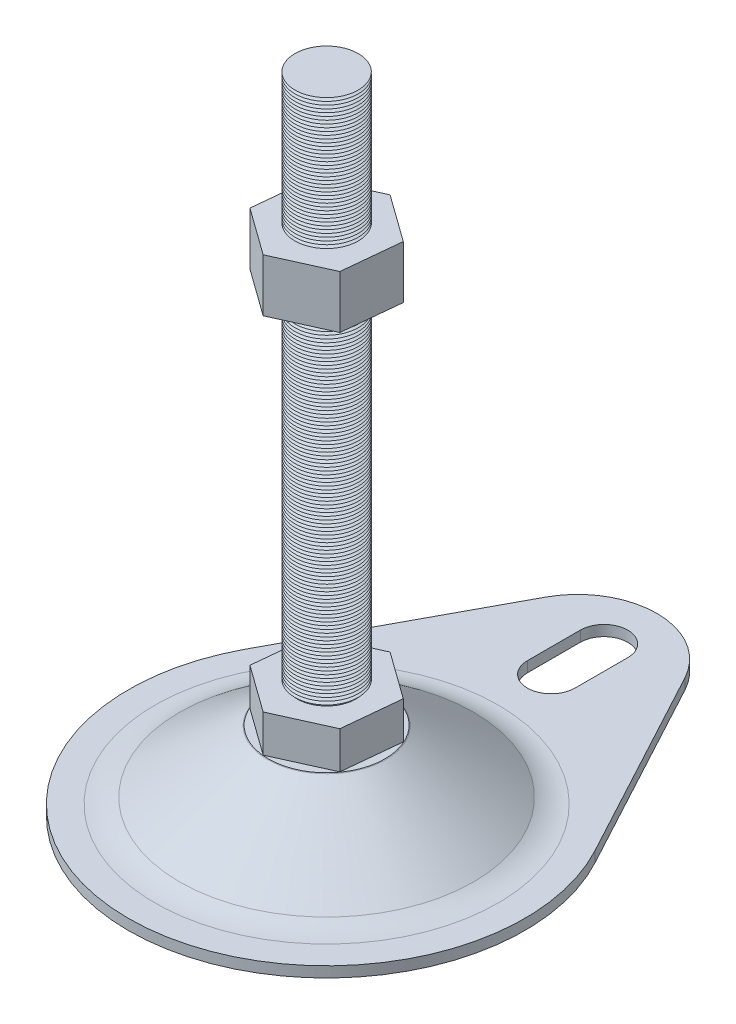
from build123d import *

# Parameters (mm, degrees)
SKETCH_3_W          = 59.979530128
SKETCH_3_H          = 60.096309618
CUT_EXTRUDE_1_DEPTH = 82
EXTRUDE_START       = -2
EXTRUDE_1_DEPTH     = 2
CUT_EXTRUDE_2_DEPTH = 141.401210821


with BuildPart() as part:
    # 草图1 → 旋转1 (revolve)
    with BuildSketch(Plane.XY, mode=Mode.PRIVATE) as revolve_1_sk:
        with BuildLine():
            Line((37.5, -12), (37.5, -14))
            Line((37.5, -14), (32.460490166, -14))
            ThreePointArc((32.460490166, -14), (29.593413351, -13.652461995), (26.89240623, -12.629978423))
            Line((26.89240623, -12.629978423), (10.251565792, -0.913347718))
            ThreePointArc((10.251565792, -0.913347718), (8.450894377, -0.231692003), (6.539509834, 0))
            Line((6.539509834, 0), (0, 0))
            Line((0, 0), (0, 108))
            Line((0, 108), (5.986831427, 108))
            Line((5.986831427, 108), (5.1, 107.695418126))
            Line((5.1, 107.695418126), (6, 107.386313512))
            Line((6, 107.386313512), (5.1, 107.077208897))
            Line((5.1, 107.077208897), (6, 106.768104283))
            Line((6, 106.768104283), (5.1, 106.458999669))
            Line((5.1, 106.458999669), (6, 106.149895054))
            Line((6, 106.149895054), (5.1, 105.84079044))
            Line((5.1, 105.84079044), (6, 105.531685826))
            Line((6, 105.531685826), (5.1, 105.222581211))
            Line((5.1, 105.222581211), (6, 104.913476597))
            Line((6, 104.913476597), (5.1, 104.604371983))
            Line((5.1, 104.604371983), (6, 104.295267368))
            Line((6, 104.295267368), (5.1, 103.986162754))
            Line((5.1, 103.986162754), (6, 103.677058139))
            Line((6, 103.677058139), (5.1, 103.367953525))
            Line((5.1, 103.367953525), (6, 103.058848911))
            Line((6, 103.058848911), (5.1, 102.749744296))
            Line((5.1, 102.749744296), (6, 102.440639682))
            Line((6, 102.440639682), (5.1, 102.131535068))
            Line((5.1, 102.131535068), (6, 101.822430453))
            Line((6, 101.822430453), (5.1, 101.513325839))
            Line((5.1, 101.513325839), (6, 101.204221225))
            Line((6, 101.204221225), (5.1, 100.89511661))
            Line((5.1, 100.89511661), (6, 100.586011996))
            Line((6, 100.586011996), (5.1, 100.276907381))
            Line((5.1, 100.276907381), (6, 99.967802767))
            Line((6, 99.967802767), (5.1, 99.658698153))
            Line((5.1, 99.658698153), (6, 99.349593538))
            Line((6, 99.349593538), (5.1, 99.040488924))
            Line((5.1, 99.040488924), (6, 98.73138431))
            Line((6, 98.73138431), (5.1, 98.422279695))
            Line((5.1, 98.422279695), (6, 98.113175081))
            Line((6, 98.113175081), (5.1, 97.804070467))
            Line((5.1, 97.804070467), (6, 97.494965852))
            Line((6, 97.494965852), (5.1, 97.185861238))
            Line((5.1, 97.185861238), (6, 96.876756623))
            Line((6, 96.876756623), (5.1, 96.567652009))
            Line((5.1, 96.567652009), (6, 96.258547395))
            Line((6, 96.258547395), (5.1, 95.94944278))
            Line((5.1, 95.94944278), (6, 95.640338166))
            Line((6, 95.640338166), (5.1, 95.331233552))
            Line((5.1, 95.331233552), (6, 95.022128937))
            Line((6, 95.022128937), (5.1, 94.713024323))
            Line((5.1, 94.713024323), (6, 94.403919709))
            Line((6, 94.403919709), (5.1, 94.094815094))
            Line((5.1, 94.094815094), (6, 93.78571048))
            Line((6, 93.78571048), (5.1, 93.476605865))
            Line((5.1, 93.476605865), (6, 93.167501251))
            Line((6, 93.167501251), (5.1, 92.858396637))
            Line((5.1, 92.858396637), (6, 92.549292022))
            Line((6, 92.549292022), (5.1, 92.240187408))
            Line((5.1, 92.240187408), (6, 91.931082794))
            Line((6, 91.931082794), (5.1, 91.621978179))
            Line((5.1, 91.621978179), (6, 91.312873565))
            Line((6, 91.312873565), (5.1, 91.00376895))
            Line((5.1, 91.00376895), (6, 90.694664336))
            Line((6, 90.694664336), (5.1, 90.385559722))
            Line((5.1, 90.385559722), (6, 90.076455107))
            Line((6, 90.076455107), (5.1, 89.767350493))
            Line((5.1, 89.767350493), (6, 89.458245879))
            Line((6, 89.458245879), (5.1, 89.149141264))
            Line((5.1, 89.149141264), (6, 88.84003665))
            Line((6, 88.84003665), (5.1, 88.530932036))
            Line((5.1, 88.530932036), (6, 88.221827421))
            Line((6, 88.221827421), (5.1, 87.912722807))
            Line((5.1, 87.912722807), (6, 87.603618192))
            Line((6, 87.603618192), (5.1, 87.294513578))
            Line((5.1, 87.294513578), (6, 86.985408964))
            Line((6, 86.985408964), (5.1, 86.676304349))
            Line((5.1, 86.676304349), (6, 86.367199735))
            Line((6, 86.367199735), (5.1, 86.058095121))
            Line((5.1, 86.058095121), (6, 85.748990506))
            Line((6, 85.748990506), (5.1, 85.439885892))
            Line((5.1, 85.439885892), (6, 85.130781278))
            Line((6, 85.130781278), (5.1, 84.821676663))
            Line((5.1, 84.821676663), (6, 84.512572049))
            Line((6, 84.512572049), (5.1, 84.203467434))
            Line((5.1, 84.203467434), (6, 83.89436282))
            Line((6, 83.89436282), (5.1, 83.585258206))
            Line((5.1, 83.585258206), (6, 83.276153591))
            Line((6, 83.276153591), (5.1, 82.967048977))
            Line((5.1, 82.967048977), (5.21854677, 82.92633414))
            Line((5.21854677, 82.92633414), (11, 82.92633414))
            Line((11, 82.92633414), (11, 72.92633414))
            Line((11, 72.92633414), (5.534902792, 72.92633414))
            Line((5.534902792, 72.92633414), (6, 72.766596703))
            Line((6, 72.766596703), (5.1, 72.457492089))
            Line((5.1, 72.457492089), (6, 72.148387474))
            Line((6, 72.148387474), (5.1, 71.83928286))
            Line((5.1, 71.83928286), (6, 71.530178245))
            Line((6, 71.530178245), (5.1, 71.221073631))
            Line((5.1, 71.221073631), (6, 70.911969017))
            Line((6, 70.911969017), (5.1, 70.602864402))
            Line((5.1, 70.602864402), (6, 70.293759788))
            Line((6, 70.293759788), (5.1, 69.984655174))
            Line((5.1, 69.984655174), (6, 69.675550559))
            Line((6, 69.675550559), (5.1, 69.366445945))
            Line((5.1, 69.366445945), (6, 69.057341331))
            Line((6, 69.057341331), (5.1, 68.748236716))
            Line((5.1, 68.748236716), (6, 68.439132102))
            Line((6, 68.439132102), (5.1, 68.130027487))
            Line((5.1, 68.130027487), (6, 67.820922873))
            Line((6, 67.820922873), (5.1, 67.511818259))
            Line((5.1, 67.511818259), (6, 67.202713644))
            Line((6, 67.202713644), (5.1, 66.89360903))
            Line((5.1, 66.89360903), (6, 66.584504416))
            Line((6, 66.584504416), (5.1, 66.275399801))
            Line((5.1, 66.275399801), (6, 65.966295187))
            Line((6, 65.966295187), (5.1, 65.657190573))
            Line((5.1, 65.657190573), (6, 65.348085958))
            Line((6, 65.348085958), (5.1, 65.038981344))
            Line((5.1, 65.038981344), (6, 64.729876729))
            Line((6, 64.729876729), (5.1, 64.420772115))
            Line((5.1, 64.420772115), (6, 64.111667501))
            Line((6, 64.111667501), (5.1, 63.802562886))
            Line((5.1, 63.802562886), (6, 63.493458272))
            Line((6, 63.493458272), (5.1, 63.184353658))
            Line((5.1, 63.184353658), (6, 62.875249043))
            Line((6, 62.875249043), (5.1, 62.566144429))
            Line((5.1, 62.566144429), (6, 62.257039815))
            Line((6, 62.257039815), (5.1, 61.9479352))
            Line((5.1, 61.9479352), (6, 61.638830586))
            Line((6, 61.638830586), (5.1, 61.329725971))
            Line((5.1, 61.329725971), (6, 61.020621357))
            Line((6, 61.020621357), (5.1, 60.711516743))
            Line((5.1, 60.711516743), (6, 60.402412128))
            Line((6, 60.402412128), (5.1, 60.093307514))
            Line((5.1, 60.093307514), (6, 59.7842029))
            Line((6, 59.7842029), (5.1, 59.475098285))
            Line((5.1, 59.475098285), (6, 59.165993671))
            Line((6, 59.165993671), (5.1, 58.856889056))
            Line((5.1, 58.856889056), (6, 58.547784442))
            Line((6, 58.547784442), (5.1, 58.238679828))
            Line((5.1, 58.238679828), (6, 57.929575213))
            Line((6, 57.929575213), (5.1, 57.620470599))
            Line((5.1, 57.620470599), (6, 57.311365985))
            Line((6, 57.311365985), (5.1, 57.00226137))
            Line((5.1, 57.00226137), (6, 56.693156756))
            Line((6, 56.693156756), (5.1, 56.384052142))
            Line((5.1, 56.384052142), (6, 56.074947527))
            Line((6, 56.074947527), (5.1, 55.765842913))
            Line((5.1, 55.765842913), (6, 55.456738298))
            Line((6, 55.456738298), (5.1, 55.147633684))
            Line((5.1, 55.147633684), (6, 54.83852907))
            Line((6, 54.83852907), (5.1, 54.529424455))
            Line((5.1, 54.529424455), (6, 54.220319841))
            Line((6, 54.220319841), (5.1, 53.911215227))
            Line((5.1, 53.911215227), (6, 53.602110612))
            Line((6, 53.602110612), (5.1, 53.293005998))
            Line((5.1, 53.293005998), (6, 52.983901384))
            Line((6, 52.983901384), (5.1, 52.674796769))
            Line((5.1, 52.674796769), (6, 52.365692155))
            Line((6, 52.365692155), (5.1, 52.05658754))
            Line((5.1, 52.05658754), (6, 51.747482926))
            Line((6, 51.747482926), (5.1, 51.438378312))
            Line((5.1, 51.438378312), (6, 51.129273697))
            Line((6, 51.129273697), (5.1, 50.820169083))
            Line((5.1, 50.820169083), (6, 50.511064469))
            Line((6, 50.511064469), (5.1, 50.201959854))
            Line((5.1, 50.201959854), (6, 49.89285524))
            Line((6, 49.89285524), (5.1, 49.583750626))
            Line((5.1, 49.583750626), (6, 49.274646011))
            Line((6, 49.274646011), (5.1, 48.965541397))
            Line((5.1, 48.965541397), (6, 48.656436782))
            Line((6, 48.656436782), (5.1, 48.347332168))
            Line((5.1, 48.347332168), (6, 48.038227554))
            Line((6, 48.038227554), (5.1, 47.729122939))
            Line((5.1, 47.729122939), (6, 47.420018325))
            Line((6, 47.420018325), (5.1, 47.110913711))
            Line((5.1, 47.110913711), (6, 46.801809096))
            Line((6, 46.801809096), (5.1, 46.492704482))
            Line((5.1, 46.492704482), (6, 46.183599868))
            Line((6, 46.183599868), (5.1, 45.874495253))
            Line((5.1, 45.874495253), (6, 45.565390639))
            Line((6, 45.565390639), (5.1, 45.256286024))
            Line((5.1, 45.256286024), (6, 44.94718141))
            Line((6, 44.94718141), (5.1, 44.638076796))
            Line((5.1, 44.638076796), (6, 44.328972181))
            Line((6, 44.328972181), (5.1, 44.019867567))
            Line((5.1, 44.019867567), (6, 43.710762953))
            Line((6, 43.710762953), (5.1, 43.401658338))
            Line((5.1, 43.401658338), (6, 43.092553724))
            Line((6, 43.092553724), (5.1, 42.783449109))
            Line((5.1, 42.783449109), (6, 42.474344495))
            Line((6, 42.474344495), (5.1, 42.165239881))
            Line((5.1, 42.165239881), (6, 41.856135266))
            Line((6, 41.856135266), (5.1, 41.547030652))
            Line((5.1, 41.547030652), (6, 41.237926038))
            Line((6, 41.237926038), (5.1, 40.928821423))
            Line((5.1, 40.928821423), (6, 40.619716809))
            Line((6, 40.619716809), (5.1, 40.310612195))
            Line((5.1, 40.310612195), (6, 40.00150758))
            Line((6, 40.00150758), (5.1, 39.692402966))
            Line((5.1, 39.692402966), (6, 39.383298351))
            Line((6, 39.383298351), (5.1, 39.074193737))
            Line((5.1, 39.074193737), (6, 38.765089123))
            Line((6, 38.765089123), (5.1, 38.455984508))
            Line((5.1, 38.455984508), (6, 38.146879894))
            Line((6, 38.146879894), (5.1, 37.83777528))
            Line((5.1, 37.83777528), (6, 37.528670665))
            Line((6, 37.528670665), (5.1, 37.219566051))
            Line((5.1, 37.219566051), (6, 36.910461437))
            Line((6, 36.910461437), (5.1, 36.601356822))
            Line((5.1, 36.601356822), (6, 36.292252208))
            Line((6, 36.292252208), (5.1, 35.983147593))
            Line((5.1, 35.983147593), (6, 35.674042979))
            Line((6, 35.674042979), (5.1, 35.364938365))
            Line((5.1, 35.364938365), (6, 35.05583375))
            Line((6, 35.05583375), (5.1, 34.746729136))
            Line((5.1, 34.746729136), (6, 34.437624522))
            Line((6, 34.437624522), (5.1, 34.128519907))
            Line((5.1, 34.128519907), (6, 33.819415293))
            Line((6, 33.819415293), (5.1, 33.510310679))
            Line((5.1, 33.510310679), (6, 33.201206064))
            Line((6, 33.201206064), (5.1, 32.89210145))
            Line((5.1, 32.89210145), (6, 32.582996835))
            Line((6, 32.582996835), (5.1, 32.273892221))
            Line((5.1, 32.273892221), (6, 31.964787607))
            Line((6, 31.964787607), (5.1, 31.655682992))
            Line((5.1, 31.655682992), (6, 31.346578378))
            Line((6, 31.346578378), (5.1, 31.037473764))
            Line((5.1, 31.037473764), (6, 30.728369149))
            Line((6, 30.728369149), (5.1, 30.419264535))
            Line((5.1, 30.419264535), (6, 30.110159921))
            Line((6, 30.110159921), (5.1, 29.801055306))
            Line((5.1, 29.801055306), (6, 29.491950692))
            Line((6, 29.491950692), (5.1, 29.182846077))
            Line((5.1, 29.182846077), (6, 28.873741463))
            Line((6, 28.873741463), (5.1, 28.564636849))
            Line((5.1, 28.564636849), (6, 28.255532234))
            Line((6, 28.255532234), (5.1, 27.94642762))
            Line((5.1, 27.94642762), (6, 27.637323006))
            Line((6, 27.637323006), (5.1, 27.328218391))
            Line((5.1, 27.328218391), (6, 27.019113777))
            Line((6, 27.019113777), (5.1, 26.710009162))
            Line((5.1, 26.710009162), (6, 26.400904548))
            Line((6, 26.400904548), (5.1, 26.091799934))
            Line((5.1, 26.091799934), (6, 25.782695319))
            Line((6, 25.782695319), (5.1, 25.473590705))
            Line((5.1, 25.473590705), (6, 25.164486091))
            Line((6, 25.164486091), (5.1, 24.855381476))
            Line((5.1, 24.855381476), (6, 24.546276862))
            Line((6, 24.546276862), (5.1, 24.237172248))
            Line((5.1, 24.237172248), (6, 23.928067633))
            Line((6, 23.928067633), (5.1, 23.618963019))
            Line((5.1, 23.618963019), (6, 23.309858404))
            Line((6, 23.309858404), (5.1, 23.00075379))
            Line((5.1, 23.00075379), (6, 22.691649176))
            Line((6, 22.691649176), (5.1, 22.382544561))
            Line((5.1, 22.382544561), (6, 22.073439947))
            Line((6, 22.073439947), (5.1, 21.764335333))
            Line((5.1, 21.764335333), (6, 21.455230718))
            Line((6, 21.455230718), (5.1, 21.146126104))
            Line((5.1, 21.146126104), (6, 20.83702149))
            Line((6, 20.83702149), (5.1, 20.527916875))
            Line((5.1, 20.527916875), (6, 20.218812261))
            Line((6, 20.218812261), (5.1, 19.909707646))
            Line((5.1, 19.909707646), (6, 19.600603032))
            Line((6, 19.600603032), (5.1, 19.291498418))
            Line((5.1, 19.291498418), (6, 18.982393803))
            Line((6, 18.982393803), (5.1, 18.673289189))
            Line((5.1, 18.673289189), (6, 18.364184575))
            Line((6, 18.364184575), (5.1, 18.05507996))
            Line((5.1, 18.05507996), (6, 17.745975346))
            Line((6, 17.745975346), (5.1, 17.436870732))
            Line((5.1, 17.436870732), (6, 17.127766117))
            Line((6, 17.127766117), (5.1, 16.818661503))
            Line((5.1, 16.818661503), (6, 16.509556888))
            Line((6, 16.509556888), (5.1, 16.200452274))
            Line((5.1, 16.200452274), (6, 15.89134766))
            Line((6, 15.89134766), (5.1, 15.582243045))
            Line((5.1, 15.582243045), (6, 15.273138431))
            Line((6, 15.273138431), (5.1, 14.964033817))
            Line((5.1, 14.964033817), (6, 14.654929202))
            Line((6, 14.654929202), (5.1, 14.345824588))
            Line((5.1, 14.345824588), (6, 14.036719974))
            Line((6, 14.036719974), (5.1, 13.727615359))
            Line((5.1, 13.727615359), (6, 13.418510745))
            Line((6, 13.418510745), (5.1, 13.10940613))
            Line((5.1, 13.10940613), (6, 12.800301516))
            Line((6, 12.800301516), (5.1, 12.491196902))
            Line((5.1, 12.491196902), (6, 12.182092287))
            Line((6, 12.182092287), (5.1, 11.872987673))
            Line((5.1, 11.872987673), (6, 11.563883059))
            Line((6, 11.563883059), (5.1, 11.254778444))
            Line((5.1, 11.254778444), (6, 10.94567383))
            Line((6, 10.94567383), (5.1, 10.636569215))
            Line((5.1, 10.636569215), (6, 10.327464601))
            Line((6, 10.327464601), (5.1, 10.018359987))
            Line((5.1, 10.018359987), (6, 9.709255372))
            Line((6, 9.709255372), (5.1, 9.400150758))
            Line((5.1, 9.400150758), (6, 9.091046144))
            Line((6, 9.091046144), (5.1, 8.781941529))
            Line((5.1, 8.781941529), (6, 8.472836915))
            Line((6, 8.472836915), (5.1, 8.163732301))
            Line((5.1, 8.163732301), (5.576728796, 8))
            Line((5.576728796, 8), (11, 8))
            Line((11, 8), (11, 0.950085334))
            Line((11, 0.950085334), (11.179579781, 0.858315353))
            Line((11.179579781, 0.858315353), (27.820420219, -10.858315353))
            ThreePointArc((27.820420219, -10.858315353), (30.071259487, -11.710384996), (32.460490166, -12))
            Line((32.460490166, -12), (37.5, -12))
        make_face()
    revolve(revolve_1_sk.sketch.rotate(Axis((0, 0, 0), (0, 1, 0)), 90), axis=Axis((0, 0, 0), (0, 1, 0)))

    # 草图3 → 切除-拉伸1 (cut)
    with BuildSketch(Plane(origin=(0, 82.92633414, 0), x_dir=(1, 0, 0), z_dir=(0, 1, 0))):
        with Locations((-1.87615052, 6.430484037)):
            Rectangle(SKETCH_3_W, SKETCH_3_H)
        Polygon((9.999249386, 4.510913993), (1.093058581, 10.915060983), (-8.906190805, 6.404146991), (-9.999249386, -4.510913993), (-1.093058581, -10.915060983), (8.906190805, -6.404146991), align=None, mode=Mode.SUBTRACT)
    extrude(amount=-CUT_EXTRUDE_1_DEPTH, mode=Mode.SUBTRACT)

    # 草图4 → 凸台-拉伸1 (add)
    with BuildSketch(Plane(origin=(0, -12, 0), x_dir=(1, 0, 0), z_dir=(0, 1, 0)).offset(EXTRUDE_START)):
        with BuildLine():
            Line((13.210421472, 54.605263158), (33.026053679, 17.763157895))
            ThreePointArc((33.026053679, 17.763157895), (0, 37.5), (-33.026053679, 17.763157895))
            Line((-33.026053679, 17.763157895), (-13.210421472, 54.605263158))
            ThreePointArc((-13.210421472, 54.605263158), (0, 62.5), (13.210421472, 54.605263158))
        make_face()
    extrude(amount=EXTRUDE_1_DEPTH)

    # 草图5 → 切除-拉伸2 (cut, through all)
    with BuildSketch(Plane(origin=(0, -12, 0), x_dir=(1, 0, 0), z_dir=(0, 1, 0))):
        with BuildLine():
            Line((-4.5, 42.5), (-4.5, 52.5))
            ThreePointArc((-4.5, 52.5), (0, 57), (4.5, 52.5))
            Line((4.5, 52.5), (4.5, 42.5))
            ThreePointArc((4.5, 42.5), (0, 38), (-4.5, 42.5))
        make_face()
    extrude(amount=-CUT_EXTRUDE_2_DEPTH, mode=Mode.SUBTRACT)


solid = part.part
